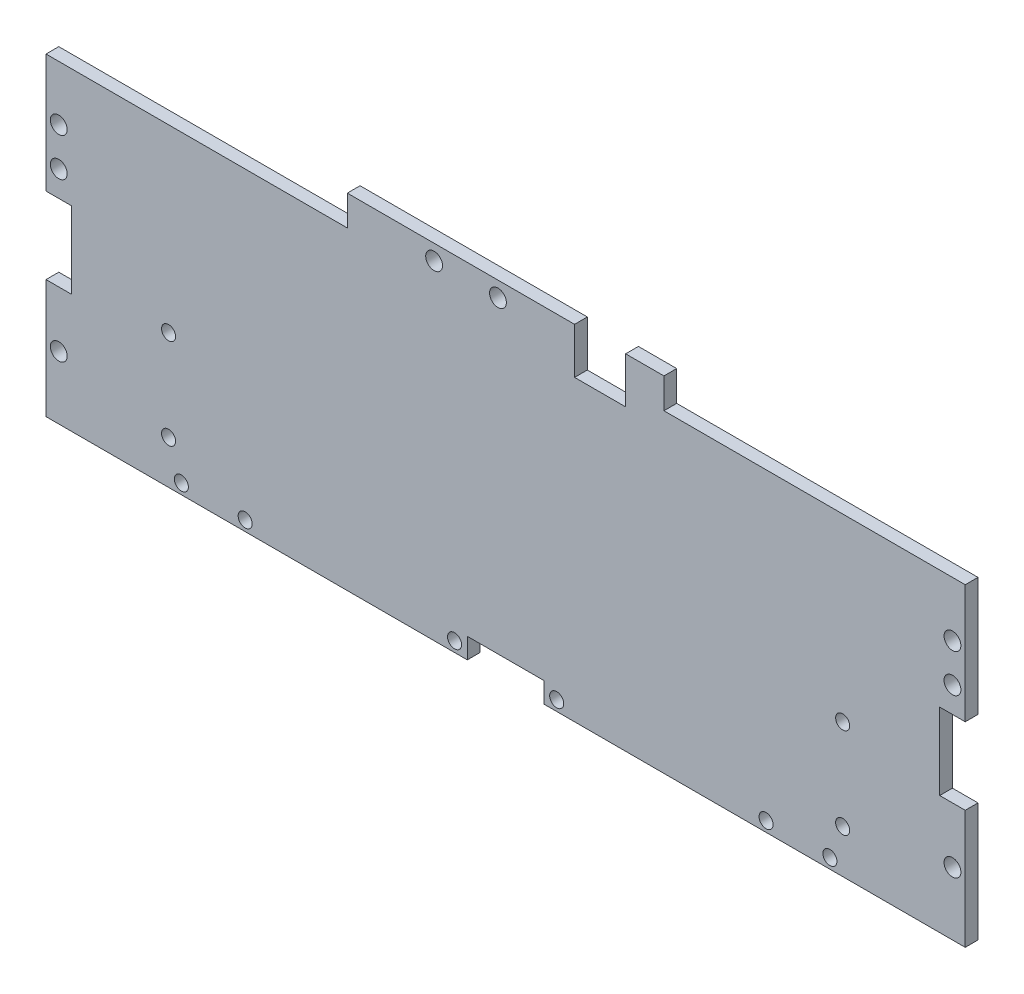
from build123d import *

# Parameters (mm, degrees)
RESSALTO_EXTRUS_O1_DEPTH = 5
FURO_COM_FOLGA_DE_M61_D  = 6.6
FURO_COM_FOLGA_DE_M51_D  = 5.5
RESSALTO_EXTRUS_O3_DEPTH = 5
CORTE_EXTRUS_O1_DEPTH    = 419.231218825
ESBO_O19_W               = 20
ESBO_O19_H               = 18
CORTE_EXTRUS_O2_DEPTH    = 385.449518663


with BuildPart() as part:
    # Esboço1 → Ressalto-extrusão1 (new body)
    with BuildSketch(Plane.XY):
        Polygon((0, 76.5), (0, 132.32), (0, 172.82), (116, 172.82), (116, 134.82), (244, 134.82), (244, 172.82), (360, 172.82), (360, 132.32), (360, 76.5), (350, 76.5), (350, 46.5), (360, 46.5), (360, 0), (195, 0), (195, 8), (165, 8), (165, 0), (0, 0), (0, 46.5), (10, 46.5), (10, 76.5), align=None)
    extrude(amount=RESSALTO_EXTRUS_O1_DEPTH)

    # Furo com folga de M61 (through all)
    with Locations(Plane(origin=(-158.278165294, -245.41916969, 5), x_dir=(-1, 0, 0), z_dir=(0, 0, 1))):
        with Locations((-163.278165294, -331.91916969), (-163.278165294, -270.06916969), (-513.278165294, -331.91916969), (-513.278165294, -270.06916969), (-458.278165294, -374.23916969), (-428.278165294, -374.23916969), (-248.278165294, -374.23916969), (-218.278165294, -374.23916969), (-335.278165294, -374.23916969), (-163.278165294, -346.91916969), (-513.278165294, -346.91916969), (-310.278165294, -374.23916969)):
            Hole(FURO_COM_FOLGA_DE_M61_D / 2)

    # Furo com folga de M51 (through all)
    with Locations(Plane(origin=(-158.278165294, -245.41916969, 5), x_dir=(-1, 0, 0), z_dir=(0, 0, 1))):
        with Locations((-470.278165294, -297.91916969), (-470.278165294, -262.41916969), (-206.278165294, -297.91916969), (-206.278165294, -262.41916969), (-465.278165294, -249.41916969), (-440.278165294, -249.41916969), (-358.278165294, -249.41916969), (-318.278165294, -249.41916969), (-236.278165294, -249.41916969), (-211.278165294, -249.41916969)):
            Hole(FURO_COM_FOLGA_DE_M51_D / 2)

    # Esboço15 → Ressalto-extrusão3 (add, through all)
    with BuildSketch(Plane.XY.offset(5)):
        Polygon((100, 172.82), (100, 212.82), (0, 172.82), align=None)
        Polygon((260, 172.82), (260, 212.82), (360, 172.82), align=None)
    extrude(amount=-RESSALTO_EXTRUS_O3_DEPTH)

    # Esboço18 → Corte-extrusão1 (cut, through all)
    with BuildSketch(Plane.XY.offset(5)):
        Polygon((118, 134.82), (118, 123), (0, 123), (0, 223), (360, 223), (360, 123), (242, 123), (242, 134.82), align=None)
    extrude(amount=-CORTE_EXTRUS_O1_DEPTH, mode=Mode.SUBTRACT)

    # Esboço19 → Corte-extrusão2 (cut, through all)
    with BuildSketch(Plane.XY.offset(5)):
        with Locations((217, 125.82)):
            Rectangle(ESBO_O19_W, ESBO_O19_H)
    extrude(amount=-CORTE_EXTRUS_O2_DEPTH, mode=Mode.SUBTRACT)


solid = part.part
